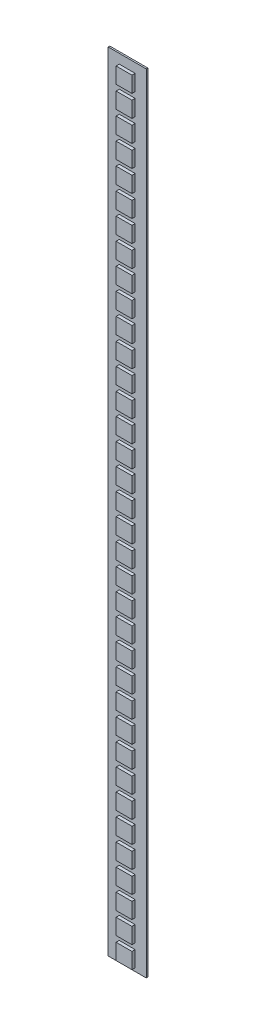
from build123d import *

# Parameters (mm, degrees)
SKETCH1_W           = 12
SKETCH1_H           = 248
BOSS_EXTRUDE1_DEPTH = 0.5
SKETCH2_W           = 5
SKETCH2_H           = 5
BOSS_EXTRUDE2_DEPTH = 1


with BuildPart() as part:
    # Sketch1 → Boss-Extrude1 (new body)
    with BuildSketch(Plane.XY):
        Rectangle(SKETCH1_W, SKETCH1_H)
    extrude(amount=BOSS_EXTRUDE1_DEPTH)

    # Sketch2 → Boss-Extrude2 (add)
    with BuildSketch(Plane.XY.offset(0.5)):
        with Locations((0, -120.5)):
            Rectangle(SKETCH2_W, SKETCH2_H)
        with Locations((0, -113.67)):
            Rectangle(SKETCH2_W, SKETCH2_H)
        with Locations((0, -106.84)):
            Rectangle(SKETCH2_W, SKETCH2_H)
        with Locations((0, -100.01)):
            Rectangle(SKETCH2_W, SKETCH2_H)
        with Locations((0, -93.18)):
            Rectangle(SKETCH2_W, SKETCH2_H)
        with Locations((0, -86.35)):
            Rectangle(SKETCH2_W, SKETCH2_H)
        with Locations((0, -79.52)):
            Rectangle(SKETCH2_W, SKETCH2_H)
        with Locations((0, -72.69)):
            Rectangle(SKETCH2_W, SKETCH2_H)
        with Locations((0, -65.86)):
            Rectangle(SKETCH2_W, SKETCH2_H)
        with Locations((0, -59.03)):
            Rectangle(SKETCH2_W, SKETCH2_H)
        with Locations((0, -52.2)):
            Rectangle(SKETCH2_W, SKETCH2_H)
        with Locations((0, -45.37)):
            Rectangle(SKETCH2_W, SKETCH2_H)
        with Locations((0, -38.54)):
            Rectangle(SKETCH2_W, SKETCH2_H)
        with Locations((0, -31.71)):
            Rectangle(SKETCH2_W, SKETCH2_H)
        with Locations((0, -24.88)):
            Rectangle(SKETCH2_W, SKETCH2_H)
        with Locations((0, -18.05)):
            Rectangle(SKETCH2_W, SKETCH2_H)
        with Locations((0, -11.22)):
            Rectangle(SKETCH2_W, SKETCH2_H)
        with Locations((0, -4.39)):
            Rectangle(SKETCH2_W, SKETCH2_H)
        with Locations((0, 2.44)):
            Rectangle(SKETCH2_W, SKETCH2_H)
        with Locations((0, 9.27)):
            Rectangle(SKETCH2_W, SKETCH2_H)
        with Locations((0, 16.1)):
            Rectangle(SKETCH2_W, SKETCH2_H)
        with Locations((0, 22.93)):
            Rectangle(SKETCH2_W, SKETCH2_H)
        with Locations((0, 29.76)):
            Rectangle(SKETCH2_W, SKETCH2_H)
        with Locations((0, 36.59)):
            Rectangle(SKETCH2_W, SKETCH2_H)
        with Locations((0, 43.42)):
            Rectangle(SKETCH2_W, SKETCH2_H)
        with Locations((0, 50.25)):
            Rectangle(SKETCH2_W, SKETCH2_H)
        with Locations((0, 57.08)):
            Rectangle(SKETCH2_W, SKETCH2_H)
        with Locations((0, 63.91)):
            Rectangle(SKETCH2_W, SKETCH2_H)
        with Locations((0, 70.74)):
            Rectangle(SKETCH2_W, SKETCH2_H)
        with Locations((0, 77.57)):
            Rectangle(SKETCH2_W, SKETCH2_H)
        with Locations((0, 84.4)):
            Rectangle(SKETCH2_W, SKETCH2_H)
        with Locations((0, 91.23)):
            Rectangle(SKETCH2_W, SKETCH2_H)
        with Locations((0, 98.06)):
            Rectangle(SKETCH2_W, SKETCH2_H)
        with Locations((0, 104.89)):
            Rectangle(SKETCH2_W, SKETCH2_H)
        with Locations((0, 111.72)):
            Rectangle(SKETCH2_W, SKETCH2_H)
        with Locations((0, 118.55)):
            Rectangle(SKETCH2_W, SKETCH2_H)
    extrude(amount=BOSS_EXTRUDE2_DEPTH)


solid = part.part
